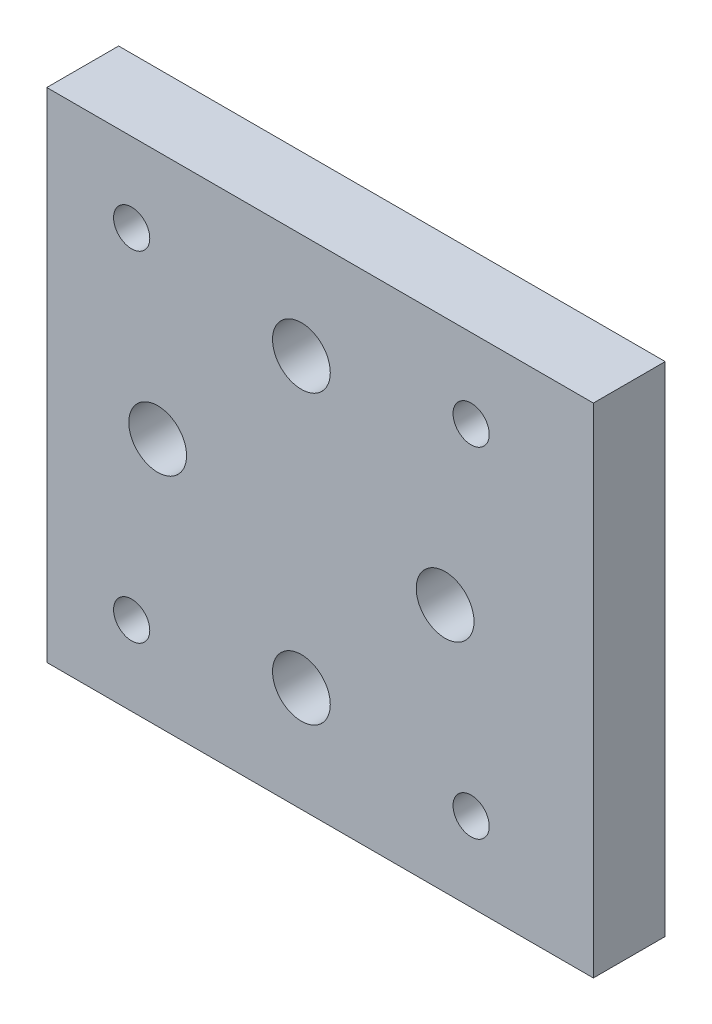
from build123d import *

# Parameters (mm, degrees)
SKETCH1_W               = 48.3
SKETCH1_H               = 44
SKETCH1_R               = 1.6
SKETCH1_R_2             = 2.5527
BOSS_EXTRUDE1_DEPTH     = 6.35
F_1_4_20_TAPPED_HOLE1_D = 5.1054


with BuildPart() as part:
    # Sketch1 → Boss-Extrude1 (new body)
    with BuildSketch(Plane.XY):
        with Locations((24.15, -22)):
            Rectangle(SKETCH1_W, SKETCH1_H)
        with Locations((7.5, -37)):
            Circle(SKETCH1_R, mode=Mode.SUBTRACT)
        with Locations((22.5, -9.3)):
            Circle(SKETCH1_R_2, mode=Mode.SUBTRACT)
        with Locations((35.2, -22)):
            Circle(SKETCH1_R_2, mode=Mode.SUBTRACT)
        with Locations((9.8, -22)):
            Circle(SKETCH1_R_2, mode=Mode.SUBTRACT)
        with Locations((22.5, -34.7)):
            Circle(SKETCH1_R_2, mode=Mode.SUBTRACT)
        with Locations((37.5, -37)):
            Circle(SKETCH1_R, mode=Mode.SUBTRACT)
        with Locations((37.5, -7)):
            Circle(SKETCH1_R, mode=Mode.SUBTRACT)
        with Locations((7.5, -7)):
            Circle(SKETCH1_R, mode=Mode.SUBTRACT)
    extrude(amount=BOSS_EXTRUDE1_DEPTH)

    # 1/4-20 Tapped Hole1 (through all)
    with Locations(Plane(origin=(22.5, -9.3, 6.35), x_dir=(1, 0, 0), z_dir=(0, 0, 1))):
        with Locations((0, 0), (12.7, -12.7), (-12.7, -12.7), (0, -25.4)):
            Hole(F_1_4_20_TAPPED_HOLE1_D / 2)


solid = part.part
